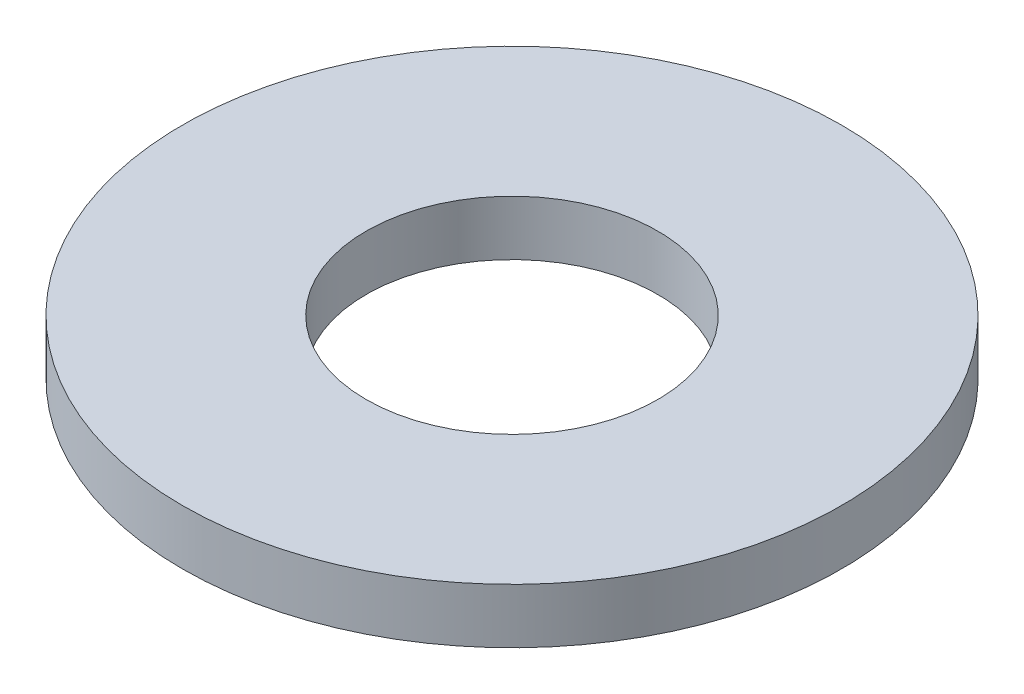
from build123d import *

# Parameters (mm, degrees)
SKETCH1_R           = 4.7625
SKETCH1_R_2         = 2.1082
BOSS_EXTRUDE1_DEPTH = 0.79375


with BuildPart() as part:
    # Sketch1 → Boss-Extrude1 (new body)
    with BuildSketch(Plane(origin=(0, 0, 0), x_dir=(1, 0, 0), z_dir=(0, 1, 0))):
        with Locations(Location((0, 0, 0), (0, 0, 270))):
            Circle(SKETCH1_R)
        with Locations(Location((0, 0, 0), (0, 0, 270))):
            Circle(SKETCH1_R_2, mode=Mode.SUBTRACT)
    extrude(amount=BOSS_EXTRUDE1_DEPTH)


solid = part.part
